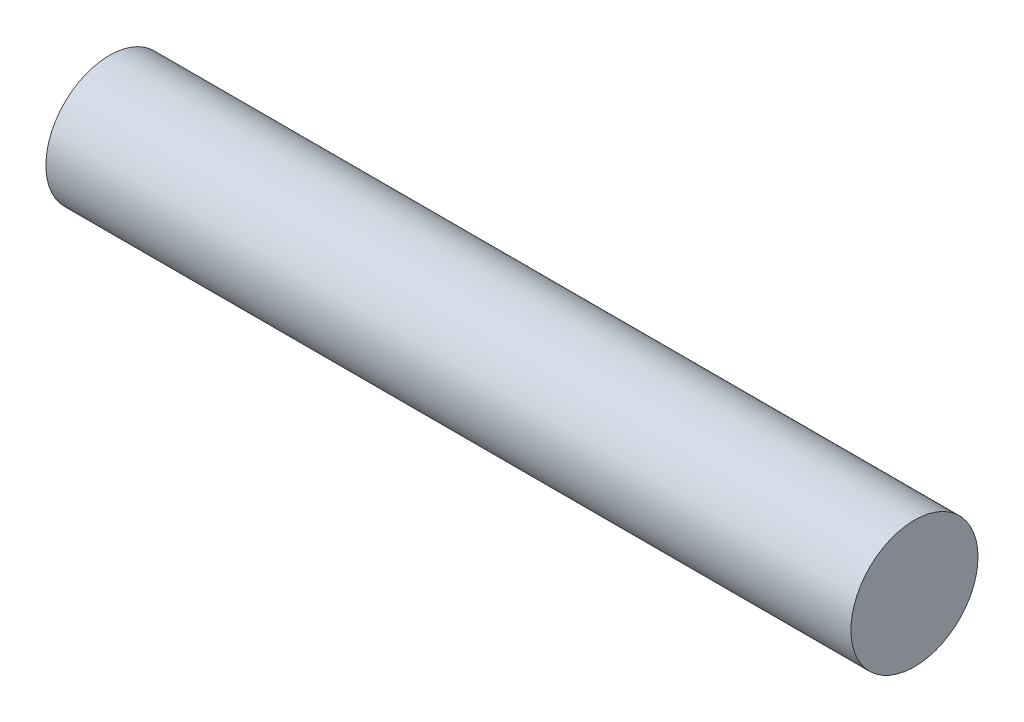
from build123d import *

# Parameters (mm, degrees)
SKETCH1_R           = 3
BOSS_EXTRUDE1_DEPTH = 19


with BuildPart() as part:
    # Sketch1 → Boss-Extrude1 (new, symmetric)
    with BuildSketch(Plane(origin=(0, 0, 0), x_dir=(0, 0, -1), z_dir=(1, 0, 0))):
        Circle(SKETCH1_R)
    extrude(amount=BOSS_EXTRUDE1_DEPTH, both=True)


solid = part.part
